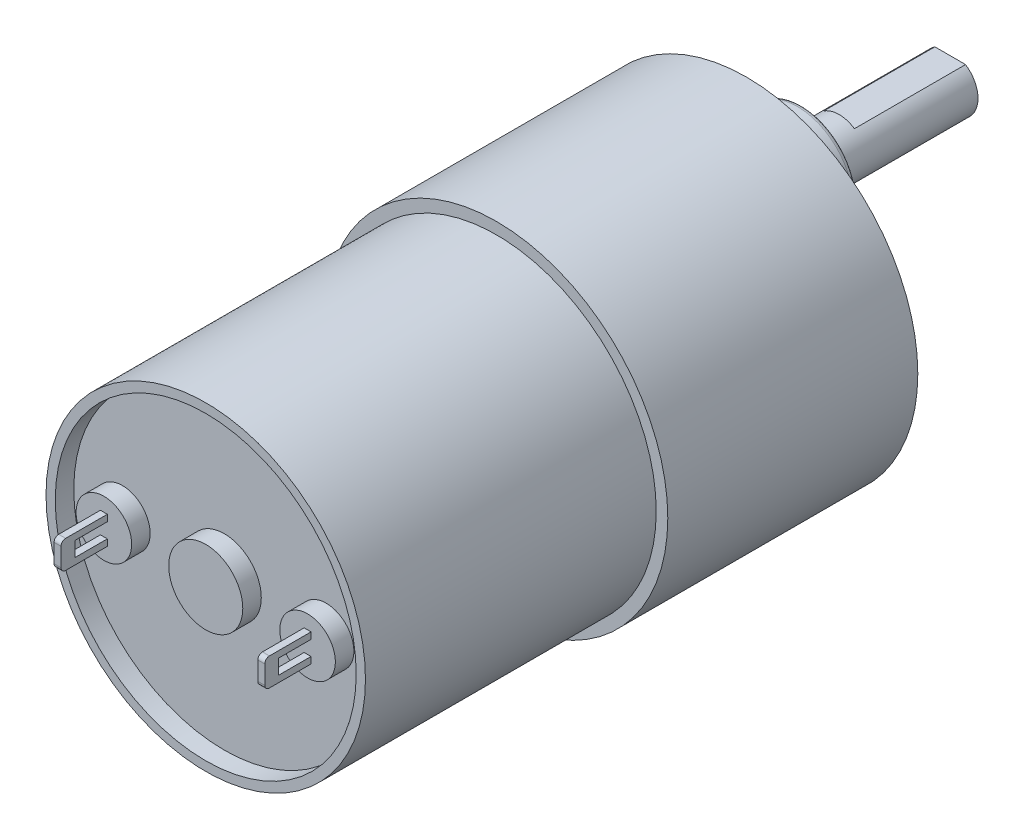
from build123d import *

# Parameters (mm, degrees)
CROQUIS1_R                = 17.25
SALIENTE_EXTRUIR1_DEPTH   = 31.4
CROQUIS2_R                = 18.5
SALIENTE_EXTRUIR2_DEPTH   = 27
CROQUIS3_R                = 6
SALIENTE_EXTRUIR3_DEPTH   = 6
CROQUIS4_R                = 3
SALIENTE_EXTRUIR4_DEPTH   = 16
CORTAR_EXTRUIR1_START     = -12
CORTAR_EXTRUIR1_DEPTH     = 12
CROQUIS8_R                = 16.25
CROQUIS8_R_2              = 4
CORTAR_EXTRUIR2_DEPTH     = 2
CROQUIS9_R                = 3
SALIENTE_EXTRUIR5_DEPTH   = 2
SALIENTE_EXTRUIR5_2_DEPTH = 2
CROQUIS10_W               = 0.75
CROQUIS10_H               = 3
SALIENTE_EXTRUIR6_DEPTH   = 5
SALIENTE_EXTRUIR6_2_DEPTH = 5
CORTAR_EXTRUIR3_START     = -25.375
CROQUIS11_W               = 3.5
CROQUIS11_H               = 1.6
CORTAR_EXTRUIR3_DEPTH     = 28
REDONDEO1_R               = 0.5
REDONDEO2_R               = 0.5
REDONDEO3_R               = 0.5
CROQUIS12_R               = 1.5
CORTAR_EXTRUIR4_DEPTH     = 3


with BuildPart() as part:
    # Croquis1 → Saliente-Extruir1 (new body)
    with BuildSketch(Plane.XY):
        Circle(CROQUIS1_R)
    extrude(amount=SALIENTE_EXTRUIR1_DEPTH)

    # Croquis2 → Saliente-Extruir2 (add)
    with BuildSketch(Plane(origin=(0, 0, 0), x_dir=(-1, 0, 0), z_dir=(0, 0, -1))):
        Circle(CROQUIS2_R)
    extrude(amount=SALIENTE_EXTRUIR2_DEPTH)

    # Croquis3 → Saliente-Extruir3 (add)
    with BuildSketch(Plane(origin=(0, 0, -27), x_dir=(-1, 0, 0), z_dir=(0, 0, -1))):
        with Locations((0, 7)):
            Circle(CROQUIS3_R)
    extrude(amount=SALIENTE_EXTRUIR3_DEPTH)

    # Croquis4 → Saliente-Extruir4 (add)
    with BuildSketch(Plane(origin=(0, 0, -33), x_dir=(-1, 0, 0), z_dir=(0, 0, -1))):
        with Locations((0, 7)):
            Circle(CROQUIS4_R)
    extrude(amount=SALIENTE_EXTRUIR4_DEPTH)

    # Croquis5 → Cortar-Extruir1 (cut)
    with BuildSketch(Plane(origin=(0, 0, -49), x_dir=(-1, 0, 0), z_dir=(0, 0, -1)).offset(CORTAR_EXTRUIR1_START)):
        with BuildLine():
            Line((-1.658312395, 9.5), (1.658312395, 9.5))
            ThreePointArc((1.658312395, 9.5), (0, 10), (-1.658312395, 9.5))
        make_face()
    extrude(amount=CORTAR_EXTRUIR1_DEPTH, mode=Mode.SUBTRACT)

    # Croquis8 → Cortar-Extruir2 (cut)
    with BuildSketch(Plane.XY.offset(31.4)):
        Circle(CROQUIS8_R)
        Circle(CROQUIS8_R_2, mode=Mode.SUBTRACT)
    extrude(amount=-CORTAR_EXTRUIR2_DEPTH, mode=Mode.SUBTRACT)

    # Redondeo3
    redondeo3_edges = [part.edges().sort_by_distance(p)[0] for p in [
        (6, 7, -33),
    ]]
    fillet(redondeo3_edges, radius=REDONDEO3_R)

    # Croquis12 → Cortar-Extruir4 (cut)
    with BuildSketch(Plane(origin=(0, 0, -27), x_dir=(-1, 0, 0), z_dir=(0, 0, -1))):
        with Locations((-15.5, 0)):
            Circle(CROQUIS12_R)
        with Locations((-7.75, 13.423393759)):
            Circle(CROQUIS12_R)
        with Locations((7.75, 13.423393759)):
            Circle(CROQUIS12_R)
        with Locations((15.5, 0)):
            Circle(CROQUIS12_R)
        with Locations((7.75, -13.423393759)):
            Circle(CROQUIS12_R)
        with Locations((-7.75, -13.423393759)):
            Circle(CROQUIS12_R)
    extrude(amount=-CORTAR_EXTRUIR4_DEPTH, mode=Mode.SUBTRACT)


with BuildPart() as body_2:
    # Croquis9 → Saliente-Extruir5 (new body)
    with BuildSketch(Plane.XY.offset(29.4)):
        with Locations((-11, 0)):
            Circle(CROQUIS9_R)
    extrude(amount=SALIENTE_EXTRUIR5_DEPTH)


with BuildPart() as body_3:
    # Croquis9 → Saliente-Extruir5 2 (new body)
    with BuildSketch(Plane.XY.offset(29.4)):
        with Locations((11, 0)):
            Circle(CROQUIS9_R)
    extrude(amount=SALIENTE_EXTRUIR5_2_DEPTH)


with BuildPart() as body_4:
    # Croquis10 → Saliente-Extruir6 (new body)
    with BuildSketch(Plane.XY.offset(31.4)):
        with Locations((-11, 0)):
            Rectangle(CROQUIS10_W, CROQUIS10_H)
    extrude(amount=SALIENTE_EXTRUIR6_DEPTH)


with BuildPart() as body_5:
    # Croquis10 → Saliente-Extruir6 2 (new body)
    with BuildSketch(Plane.XY.offset(31.4)):
        with Locations((11, 0)):
            Rectangle(CROQUIS10_W, CROQUIS10_H)
    extrude(amount=SALIENTE_EXTRUIR6_2_DEPTH)


with BuildPart() as cortar_extruir3_tool:
    # Croquis11 → Cortar-Extruir3 (new body)
    with BuildSketch(Plane.ZY.offset(11.375).offset(CORTAR_EXTRUIR3_START)):
        with Locations((33.15, 0)):
            Rectangle(CROQUIS11_W, CROQUIS11_H)
    extrude(amount=CORTAR_EXTRUIR3_DEPTH)


with BuildPart() as body_4_1:
    add(body_4.part)

    # Cortar-Extruir3: cut by cortar_extruir3_tool
    add(cortar_extruir3_tool.part, mode=Mode.SUBTRACT)

    # Redondeo1
    redondeo1_edges = [body_4_1.edges().sort_by_distance(p)[0] for p in [
        (-11, 1.5, 36.4),
        (-11, -1.5, 36.4),
    ]]
    fillet(redondeo1_edges, radius=REDONDEO1_R)


with BuildPart() as body_5_1:
    add(body_5.part)

    # Cortar-Extruir3: cut by cortar_extruir3_tool
    add(cortar_extruir3_tool.part, mode=Mode.SUBTRACT)

    # Redondeo2
    redondeo2_edges = [body_5_1.edges().sort_by_distance(p)[0] for p in [
        (11, 1.5, 36.4),
        (11, -1.5, 36.4),
    ]]
    fillet(redondeo2_edges, radius=REDONDEO2_R)


solid = Compound([part.part, body_2.part, body_3.part, body_4_1.part, body_5_1.part])
